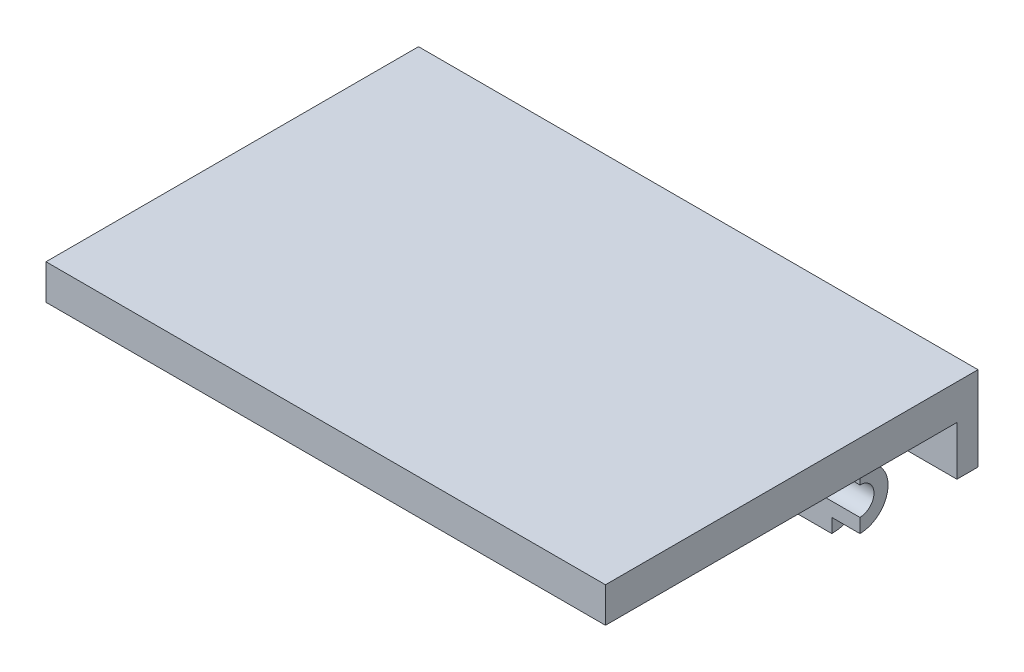
from build123d import *

# Parameters (mm, degrees)
IZIM2_W                          = 40
IZIM2_H                          = 16
Y_KSEKLIK_EKSTR_ZYON4_DEPTH      = 9
Y_KSEKLIK_EKSTR_ZYON5_DEPTH      = 2
Y_KSEKLIK_EKSTR_ZYON5_DEPTH_BACK = 42
Y_KSEKLIK_EKSTR_ZYON6_DEPTH      = 6
Y_KSEKLIK_EKSTR_ZYON6_DEPTH_BACK = 46
KES_EKSTR_ZYON1_DEPTH            = 52
KES_EKSTR_ZYON2_DEPTH            = 53.347615077
KES_EKSTR_ZYON2_DEPTH_BACK       = 52
Y_KSEKLIK_EKSTR_ZYON7_START      = -44
Y_KSEKLIK_EKSTR_ZYON7_DEPTH      = 44
KES_EKSTR_ZYON4_DEPTH            = 44
KES_EKSTR_ZYON8_START            = -2.2
KES_EKSTR_ZYON8_DEPTH            = 2.2
KES_EKSTR_ZYON9_DEPTH            = 2.2
IZIM14_W                         = 39.6
IZIM14_H                         = 3
ARALIK_EKS_DEPTH                 = 0.6
Y_KSEKLIK_EKSTR_ZYON9_DEPTH      = 12
Y_KSEKLIK_EKSTR_ZYON10_DEPTH     = 50
IZIM17_R                         = 1.95
IZIM17_W                         = 4.9
IZIM17_H                         = 4.9
Y_KSEKLIK_EKSTR_ZYON11_DEPTH     = 3.4
KES_EKSTR_ZYON11_DEPTH           = 0.8
KES_EKSTR_ZYON12_DEPTH           = 2


with BuildPart() as part:
    # Çizim2 → Yükseklik-Ekstrüzyon4 (new body)
    with BuildSketch(Plane.XY):
        with Locations((-27.243761407, 15.308213235)):
            Rectangle(IZIM2_W, IZIM2_H)
    extrude(amount=Y_KSEKLIK_EKSTR_ZYON4_DEPTH)

    # Çizim3 → Yükseklik-Ekstrüzyon5 (add, two sides: drawn at the far end of the back side and taken through both)
    with BuildSketch(Plane(origin=(-7.243761407, 0, 0), x_dir=(0, 0, -1), z_dir=(1, 0, 0)).offset(-Y_KSEKLIK_EKSTR_ZYON5_DEPTH_BACK)):
        with BuildLine():
            ThreePointArc((-9, 9.308213235), (-3, 15.308213235), (-9, 21.308213235))
            Line((-9, 21.308213235), (-9, 19.308213235))
            ThreePointArc((-9, 19.308213235), (-5, 15.308213235), (-9, 11.308213235))
            Line((-9, 11.308213235), (-9, 9.308213235))
        make_face()
    extrude(amount=Y_KSEKLIK_EKSTR_ZYON5_DEPTH + Y_KSEKLIK_EKSTR_ZYON5_DEPTH_BACK)

    # Çizim3<3> → Yükseklik-Ekstrüzyon6 (add, two sides: drawn at the far end of the back side and taken through both)
    with BuildSketch(Plane(origin=(-7.243761407, 0, 0), x_dir=(0, 0, -1), z_dir=(1, 0, 0)).offset(-Y_KSEKLIK_EKSTR_ZYON6_DEPTH_BACK)):
        with BuildLine():
            ThreePointArc((-9, 11.308213235), (-5, 15.308213235), (-9, 19.308213235))
            Line((-9, 19.308213235), (-9, 11.308213235))
        make_face()
    extrude(amount=Y_KSEKLIK_EKSTR_ZYON6_DEPTH + Y_KSEKLIK_EKSTR_ZYON6_DEPTH_BACK)

    # Çizim4 → Kes-Ekstrüzyon1 (cut)
    with BuildSketch(Plane(origin=(-1.243761407, 0, 0), x_dir=(0, 0, -1), z_dir=(1, 0, 0))):
        with BuildLine():
            Line((-9, 17.308213235), (-9, 13.308213235))
            ThreePointArc((-9, 13.308213235), (-7, 15.308213235), (-9, 17.308213235))
        make_face()
    extrude(amount=-KES_EKSTR_ZYON1_DEPTH, mode=Mode.SUBTRACT)

    # Çizim3<4> → Kes-Ekstrüzyon2 (cut, two sides: drawn at the far end of the back side and taken through both)
    with BuildSketch(Plane(origin=(-7.243761407, 0, 0), x_dir=(0, 0, -1), z_dir=(1, 0, 0)).offset(-KES_EKSTR_ZYON2_DEPTH_BACK)):
        with BuildLine():
            Line((-9, 23.308213235), (-9, 21.308213235))
            ThreePointArc((-9, 21.308213235), (-3, 15.308213235), (-9, 9.308213235))
            Line((-9, 9.308213235), (-9, 7.308213235))
            Line((-9, 7.308213235), (0, 7.308213235))
            Line((0, 7.308213235), (0, 23.308213235))
            Line((0, 23.308213235), (-9, 23.308213235))
        make_face()
    extrude(amount=KES_EKSTR_ZYON2_DEPTH + KES_EKSTR_ZYON2_DEPTH_BACK, mode=Mode.SUBTRACT)

    # Çizim7 → Yükseklik-Ekstrüzyon7 (add)
    with BuildSketch(Plane(origin=(-5.243761407, 0, 0), x_dir=(0, 0, -1), z_dir=(1, 0, 0)).offset(Y_KSEKLIK_EKSTR_ZYON7_START)):
        with BuildLine():
            Line((-5, 19.78034919), (-5, 24.308213235))
            Line((-5, 24.308213235), (-9, 24.308213235))
            Line((-9, 24.308213235), (-9, 21.308213235))
            ThreePointArc((-9, 21.308213235), (-6.859067461, 20.913247389), (-5, 19.78034919))
        make_face()
    extrude(amount=Y_KSEKLIK_EKSTR_ZYON7_DEPTH)

    # Çizim8 → Kes-Ekstrüzyon4 (cut)
    with BuildSketch(Plane.XY.offset(9)):
        Polygon((-7.443761407, 24.308213235), (-7.443761407, 21.308213235), (-5.243761407, 21.308213235), (-5.243761407, 22.308213235), (-5.243761407, 24.308213235), align=None)
        Polygon((-49.243761407, 24.308213235), (-47.043761407, 24.308213235), (-47.043761407, 21.308213235), (-49.243761407, 21.308213235), (-49.243761407, 22.308213235), align=None)
    extrude(amount=-KES_EKSTR_ZYON4_DEPTH, mode=Mode.SUBTRACT)

    # Çizim7<3> → Kes-Ekstrüzyon8 (cut)
    with BuildSketch(Plane(origin=(-5.243761407, 0, 0), x_dir=(0, 0, -1), z_dir=(1, 0, 0)).offset(KES_EKSTR_ZYON8_START)):
        with BuildLine():
            Line((-5, 19.78034919), (-5, 24.308213235))
            Line((-5, 24.308213235), (-9, 24.308213235))
            Line((-9, 24.308213235), (-9, 21.308213235))
            ThreePointArc((-9, 21.308213235), (-6.859067461, 20.913247389), (-5, 19.78034919))
        make_face()
    extrude(amount=KES_EKSTR_ZYON8_DEPTH, mode=Mode.SUBTRACT)

    # Çizim12 → Kes-Ekstrüzyon9 (cut)
    with BuildSketch(Plane.ZY.offset(49.243761407)):
        with BuildLine():
            Line((5, 19.78034919), (5, 21.308213235))
            Line((5, 21.308213235), (9, 21.308213235))
            ThreePointArc((9, 21.308213235), (6.859067461, 20.913247389), (5, 19.78034919))
        make_face()
    extrude(amount=-KES_EKSTR_ZYON9_DEPTH, mode=Mode.SUBTRACT)

    # Çizim14 → aralik_eks (add)
    with BuildSketch(Plane(origin=(0, 24.308213235, 0), x_dir=(1, 0, 0), z_dir=(0, 1, 0))):
        with Locations((-27.243761407, -7.5)):
            Rectangle(IZIM14_W, IZIM14_H)
    extrude(amount=ARALIK_EKS_DEPTH)

    # Çizim15 → Yükseklik-Ekstrüzyon9 (add)
    with BuildSketch(Plane(origin=(0, 24.908213235, 0), x_dir=(1, 0, 0), z_dir=(0, 1, 0))):
        Polygon((-47.043761407, -6), (-67.043761407, -6), (-67.043761407, -9), (-47.043761407, -9), (-7.443761407, -9), (12.556238593, -9), (12.556238593, -6), (-7.443761407, -6), align=None)
    extrude(amount=Y_KSEKLIK_EKSTR_ZYON9_DEPTH)

    # Çizim16 → Yükseklik-Ekstrüzyon10 (add)
    with BuildSketch(Plane.XY.offset(9)):
        Polygon((-67.043761407, 36.908213235), (12.556238593, 36.908213235), (12.556238593, 31.908213235), (9.556238593, 31.908213235), (9.556238593, 35.308213235), (-64.043761407, 35.308213235), (-64.043761407, 31.908213235), (-67.043761407, 31.908213235), align=None)
    extrude(amount=Y_KSEKLIK_EKSTR_ZYON10_DEPTH)

    # Çizim17 → Yükseklik-Ekstrüzyon11 (add)
    # profile 1 of 3: a face of its own
    with BuildSketch(Plane.XZ.offset(-35.308213235)):
        Polygon((9.556238593, 59), (-64.043761407, 59), (-64.043761407, 51.1), (-59.143761407, 51.1), (-59.143761407, 56), (4.656238593, 56), (4.656238593, 51.1), (9.556238593, 51.1), align=None)
        with Locations((7.106238593, 53.55)):
            Circle(IZIM17_R, mode=Mode.SUBTRACT)
        with Locations((-61.593761407, 53.55)):
            Circle(IZIM17_R, mode=Mode.SUBTRACT)
    # profile 2 of 3: a face of its own
    with BuildSketch(Plane.XZ.offset(-35.308213235)):
        with Locations((7.106238593, 14.45)):
            Rectangle(IZIM17_W, IZIM17_H)
        with Locations((7.106238593, 14.45)):
            Circle(IZIM17_R, mode=Mode.SUBTRACT)
    # profile 3 of 3: a face of its own
    with BuildSketch(Plane.XZ.offset(-35.308213235)):
        with Locations((-61.593761407, 14.45)):
            Rectangle(IZIM17_W, IZIM17_H)
        with Locations((-61.593761407, 14.45)):
            Circle(IZIM17_R, mode=Mode.SUBTRACT)
    extrude(amount=Y_KSEKLIK_EKSTR_ZYON11_DEPTH)

    # Çizim18 → Kes-Ekstrüzyon11 (cut)
    with BuildSketch(Plane.XY.offset(9)):
        with BuildLine():
            Line((-39.543761407, 28.308213235), (-39.543761407, 17.308213235))
            ThreePointArc((-39.543761407, 17.308213235), (-38.000834326, 15.938341904), (-36.30655982, 14.760799827))
            Line((-36.30655982, 14.760799827), (-18.180962994, 14.760799827))
            ThreePointArc((-18.180962994, 14.760799827), (-16.486688488, 15.938341904), (-14.943761407, 17.308213235))
            Line((-14.943761407, 17.308213235), (-14.943761407, 28.308213235))
            Line((-14.943761407, 28.308213235), (-7.443761407, 35.308213235))
            Line((-7.443761407, 35.308213235), (-47.043761407, 35.308213235))
            Line((-47.043761407, 35.308213235), (-39.543761407, 28.308213235))
        make_face()
    extrude(amount=-KES_EKSTR_ZYON11_DEPTH, mode=Mode.SUBTRACT)

    # Çizim19 → Kes-Ekstrüzyon12 (cut)
    with BuildSketch(Plane.XY.offset(9)):
        Polygon((-10.243761407, 18.606911619), (-8.625727418, 19.782482123), (-9.243761407, 21.684595156), (-11.243761407, 21.684595156), (-11.861795396, 19.782482123), align=None)
        Polygon((-42.625727418, 19.782482123), (-44.243761407, 18.606911619), (-45.861795396, 19.782482123), (-45.243761407, 21.684595156), (-43.243761407, 21.684595156), align=None)
    extrude(amount=-KES_EKSTR_ZYON12_DEPTH, mode=Mode.SUBTRACT)


solid = part.part
